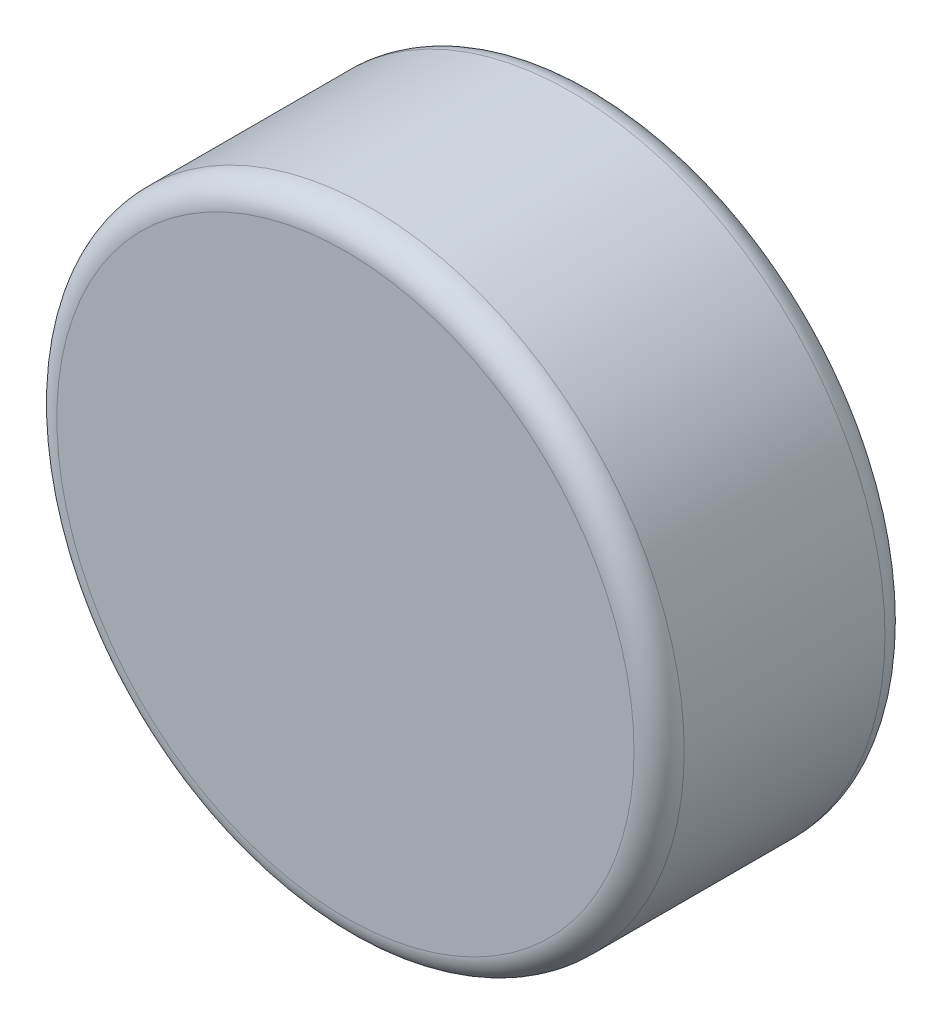
from build123d import *

# Parameters (mm, degrees)
SKETCH1_R           = 3.175
BOSS_EXTRUDE1_DEPTH = 2.54
FILLET2_R           = 0.254
FILLET3_R           = 0.254


with BuildPart() as part:
    # Sketch1 → Boss-Extrude1 (new body)
    with BuildSketch(Plane.XY):
        Circle(SKETCH1_R)
    extrude(amount=BOSS_EXTRUDE1_DEPTH)

    # Fillet2
    fillet2_edges = [part.edges().sort_by_distance(p)[0] for p in [
        (-3.175, 0, 0),
    ]]
    fillet(fillet2_edges, radius=FILLET2_R)

    # Fillet3
    fillet3_edges = [part.edges().sort_by_distance(p)[0] for p in [
        (-3.175, 0, 2.54),
    ]]
    fillet(fillet3_edges, radius=FILLET3_R)


solid = part.part
